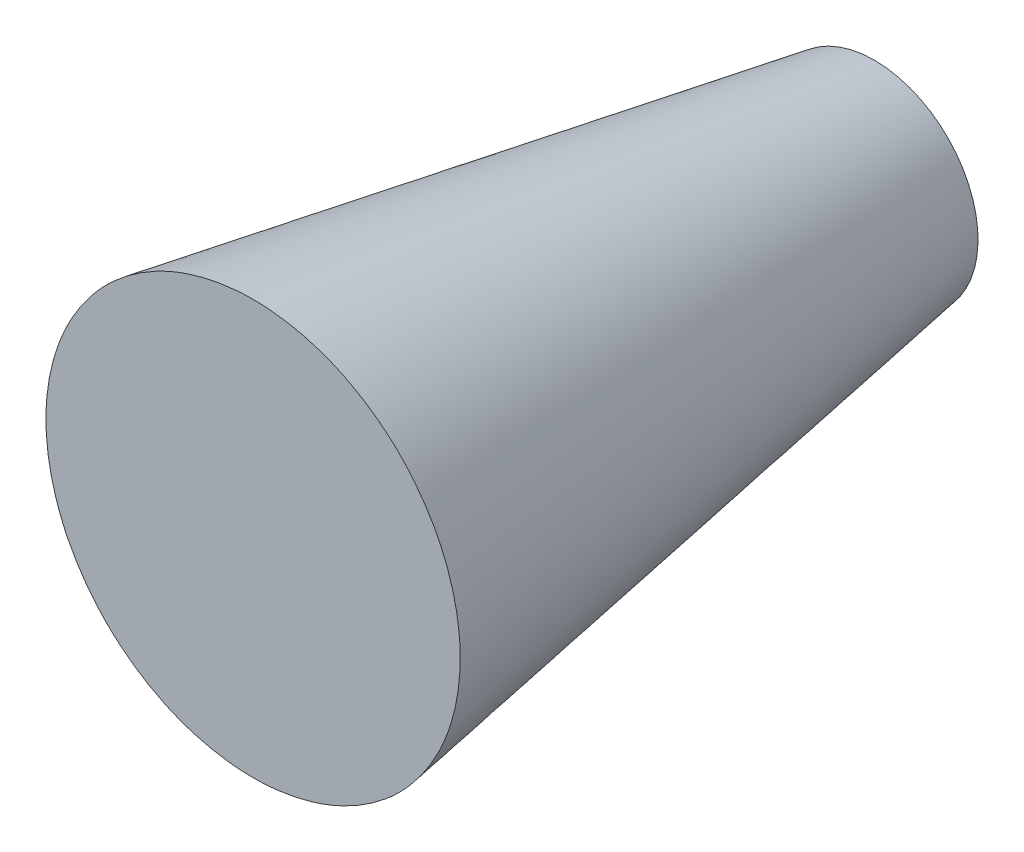
from build123d import *

# Parameters (mm, degrees)
PROFILE1_R = 5
PROFILE2_R = 7.5
PROFILE3_R = 10


with BuildPart() as part:
    # Profile1 → loft_three_sections section 0
    with BuildSketch(Plane.XY):
        Circle(PROFILE1_R)
    # Profile2 → loft_three_sections section 1
    with BuildSketch(Plane.XY.offset(15)):
        Circle(PROFILE2_R)
    # Profile3 → loft_three_sections section 2
    with BuildSketch(Plane.XY.offset(30)):
        Circle(PROFILE3_R)
    loft()


solid = part.part
